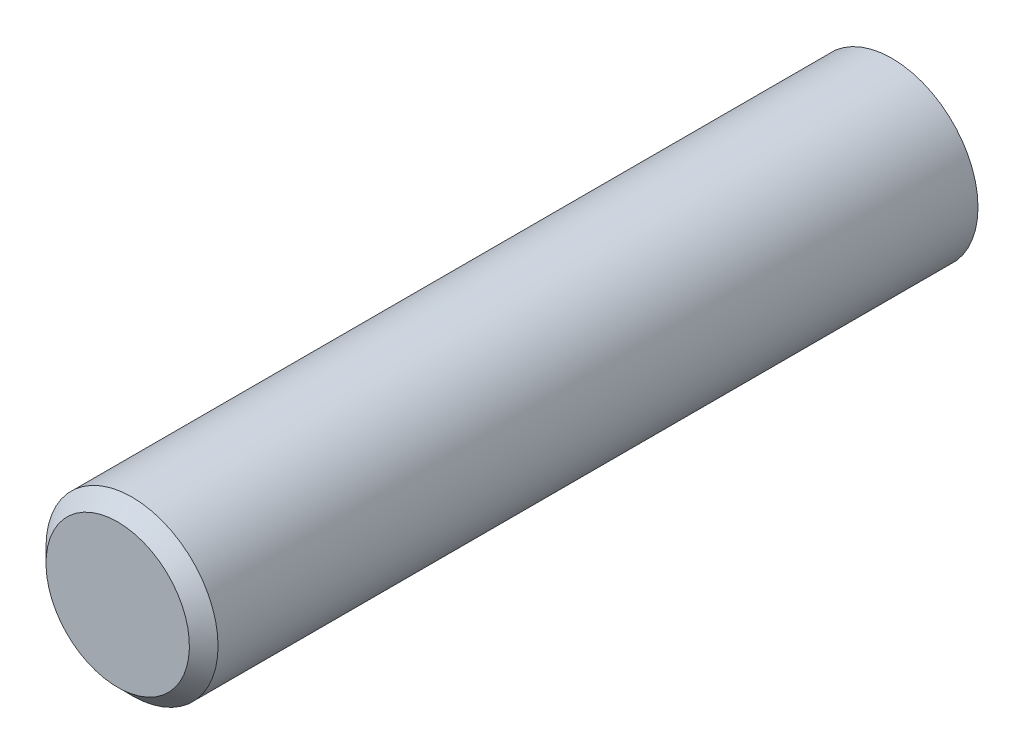
from build123d import *

# Parameters (mm, degrees)
F_3_1_3_175_DURCHMESSER_BOHRUNG1_D     = 3.175
F_3_1_3_175_DURCHMESSER_BOHRUNG1_DEPTH = 10
F_3_1_3_175_DURCHMESSER_BOHRUNG1_TIP   = 0.953866233
FASE1_SIZE                             = 0.5


with BuildPart() as part:
    # Skizze1 → Rotation1 (revolve)
    with BuildSketch(Plane(origin=(78.75, 0, 0), x_dir=(0, 0, -1), z_dir=(1, 0, 0)), mode=Mode.PRIVATE) as rotation1_sk:
        Polygon((-2, 3), (-2, 0), (-22, 0), (-29, 0), (-29, 3), (-22, 3), align=None)
    revolve(rotation1_sk.sketch.rotate(Axis((78.75, 0, 22), (0, 0, -1)), 180), axis=Axis((78.75, 0, 22), (0, 0, -1)))

    # Ø3.1 (3.175) Durchmesser Bohrung1
    with Locations(Plane(origin=(0, 0, 2), x_dir=(-1, 0, 0), z_dir=(0, 0, -1))):
        with Locations((-78.75, 0)):
            Hole(F_3_1_3_175_DURCHMESSER_BOHRUNG1_D / 2, depth=F_3_1_3_175_DURCHMESSER_BOHRUNG1_DEPTH)
            with Locations((0, 0, -(F_3_1_3_175_DURCHMESSER_BOHRUNG1_DEPTH + F_3_1_3_175_DURCHMESSER_BOHRUNG1_TIP / 2))):  # 118° drill point
                Cone(0, F_3_1_3_175_DURCHMESSER_BOHRUNG1_D / 2, F_3_1_3_175_DURCHMESSER_BOHRUNG1_TIP, mode=Mode.SUBTRACT)

    # Fase1
    fase1_edges = [part.edges().sort_by_distance(p)[0] for p in [
        (78.75, 3, 29),
    ]]
    chamfer(fase1_edges, length=FASE1_SIZE)


solid = part.part
